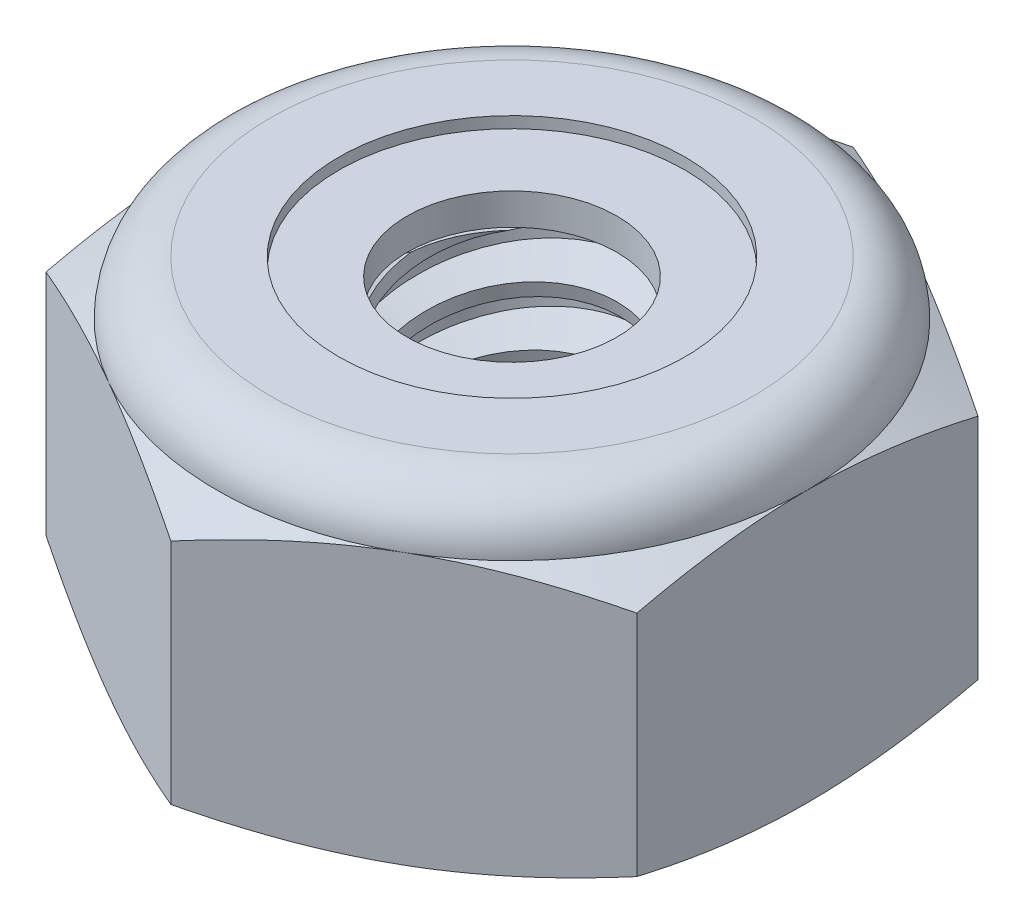
from build123d import *

# Parameters (mm, degrees)
EXTRUDE1_DEPTH      = 4.365625
SKETCH2_W           = 1.7526
SKETCH2_H           = 4.365625
LPATTERN1_COUNT     = 6
LPATTERN1_PITCH     = 0.79375
LPATTERN1_COL_COUNT = 2
LPATTERN1_COL_PITCH = 0.79375


with BuildPart() as part:
    # Sketch1 → Extrude1 (new body)
    with BuildSketch(Plane(origin=(0, 0, 0), x_dir=(1, 0, 0), z_dir=(0, 1, 0))):
        Polygon((0, 4.582717762), (-3.96875, 2.291358881), (-3.96875, -2.291358881), (0, -4.582717762), (3.96875, -2.291358881), (3.96875, 2.291358881), align=None)
    extrude(amount=EXTRUDE1_DEPTH)

    # Sketch4 → Cut-Revolve2 (revolve, cut)
    with BuildSketch(Plane(origin=(0, 0, 0), x_dir=(0, 0, -1), z_dir=(1, 0, 0)), mode=Mode.PRIVATE) as cut_revolve2_sk:
        Polygon((0, 4.365625), (1.7526, 4.365625), (1.410275607, 4.205996514), (1.410275607, 0.159628486), (1.7526, 0), (0, 0), align=None)
    revolve(cut_revolve2_sk.sketch.rotate(Axis((0, 4.365625, 0), (0, 1, 0)), 47.958361099), axis=Axis((0, 4.365625, 0), (0, 1, 0)), mode=Mode.SUBTRACT)


with BuildPart() as body_2:
    # Sketch2 → Revolve1 (revolve)
    with BuildSketch(Plane(origin=(0, 0, 0), x_dir=(0, 0, -1), z_dir=(1, 0, 0))):
        with Locations((0.8763, 2.1828125)):
            Rectangle(SKETCH2_W, SKETCH2_H)
    revolve(axis=Axis((0, -1.7526, 0), (0, 1, 0)))

    # Sketch3 → Cut-Revolve1 (revolve, cut)
    with BuildSketch(Plane(origin=(0, 0, 0), x_dir=(0, 0, -1), z_dir=(1, 0, 0)), mode=Mode.PRIVATE) as cut_revolve1_sk:
        Polygon((1.774513192, 4.268856346), (1.927905533, 3.591475768), (1.454101991, 3.7385105), (1.410275607, 3.932047808), align=None)
    cut_revolve1 = revolve(cut_revolve1_sk.sketch.rotate(Axis((0, 4.365625, 0.193538035), (0, -0.9753061185369931, -0.22085736379913792)), 180), axis=Axis((0, 4.365625, 0.193538035), (0, -0.9753061185369931, -0.22085736379913792)), mode=Mode.SUBTRACT)

    # LPattern1: Cut-Revolve1 ×6
    with Locations(*[(0, -i * LPATTERN1_PITCH, 0) for i in range(1, LPATTERN1_COUNT)]):
        add(cut_revolve1, mode=Mode.SUBTRACT)

    # LPattern1 col: Cut-Revolve1 ×2
    with Locations(*[(0, i * LPATTERN1_COL_PITCH, 0) for i in range(1, LPATTERN1_COL_COUNT)]):
        add(cut_revolve1, mode=Mode.SUBTRACT)


with BuildPart() as part_1:
    add(part.part)

    # Combine1: cut body 2
    add(body_2.part, mode=Mode.SUBTRACT)

    # Sketch5 → Cut-Revolve3 (revolve, cut)
    with BuildSketch(Plane(origin=(0, 0, 0), x_dir=(0, 0, -1), z_dir=(1, 0, 0)), mode=Mode.PRIVATE) as cut_revolve3_sk:
        with BuildLine():
            Line((0, 0), (3.96875, 0))
            Line((3.96875, 0), (4.582717762, 0.286297869))
            Line((4.582717762, 0.286297869), (4.582717762, 3.351722964))
            Line((4.582717762, 3.351722964), (3.96875, 3.638020833))
            ThreePointArc((3.96875, 3.638020833), (3.755639674, 4.152514674), (3.241145833, 4.365625))
            Line((3.241145833, 4.365625), (3.241145833, 5.635625))
            Line((3.241145833, 5.635625), (5.852717762, 5.635625))
            Line((5.852717762, 5.635625), (5.852717762, -1.27))
            Line((5.852717762, -1.27), (0, -1.27))
            Line((0, -1.27), (0, 0))
        make_face()
    revolve(cut_revolve3_sk.sketch.rotate(Axis((0, 0, 0), (0, 1, 0)), 47.958361099), axis=Axis((0, 0, 0), (0, 1, 0)), mode=Mode.SUBTRACT)

    # Sketch6 → Cut-Revolve4 (revolve, cut)
    with BuildSketch(Plane(origin=(0, 0, 0), x_dir=(0, 0, -1), z_dir=(1, 0, 0)), mode=Mode.PRIVATE) as cut_revolve4_sk:
        with BuildLine():
            Line((0, 3.638020833), (3.81635, 3.638020833))
            ThreePointArc((3.81635, 3.638020833), (3.6478766, 4.0447516), (3.241145833, 4.213225))
            Line((3.241145833, 4.213225), (2.32571072, 4.213225))
            Line((2.32571072, 4.213225), (2.32571072, 5.635625))
            Line((2.32571072, 5.635625), (0, 5.635625))
            Line((0, 5.635625), (0, 3.638020833))
        make_face()
    revolve(cut_revolve4_sk.sketch.rotate(Axis((0, 5.635625, 0), (0, 1, 0)), 11.653123147), axis=Axis((0, 5.635625, 0), (0, 1, 0)), mode=Mode.SUBTRACT)


with BuildPart() as body_2_2:
    # Sketch7 → Revolve2 (revolve)
    with BuildSketch(Plane(origin=(0, 0, 0), x_dir=(0, 0, -1), z_dir=(1, 0, 0))):
        with BuildLine():
            Line((1.410275607, 3.714220833), (3.734297654, 3.714220833))
            ThreePointArc((3.734297654, 3.714220833), (3.565938876, 4.016854092), (3.241145833, 4.137025))
            Line((3.241145833, 4.137025), (1.410275607, 4.137025))
            Line((1.410275607, 4.137025), (1.410275607, 3.714220833))
        make_face()
    revolve(axis=Axis((0, 3.714220833, 0), (0, 1, 0)))


solid = Compound([part_1.part, body_2_2.part])
